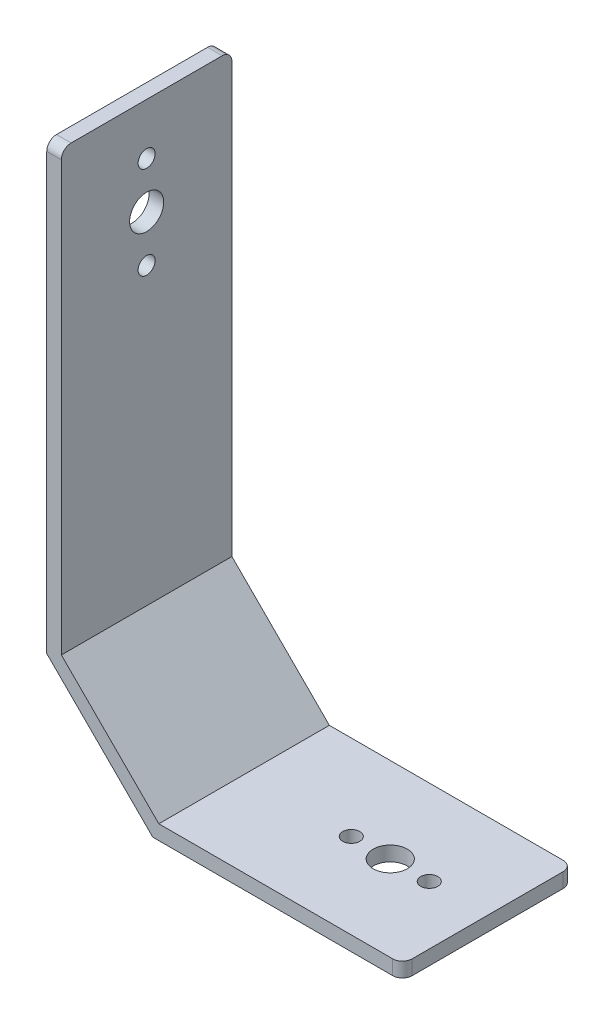
from build123d import *

# Parameters (mm, degrees)
EXTRU_MINCE1_DEPTH      = 35
ESQUISSE2_R             = 1.75
ESQUISSE2_R_2           = 3.5
ENL_V_MAT_EXTRU_1_DEPTH = 3
CONG_3_R                = 2
CONG_4_R                = 2
CONG_5_R                = 2
CONG_6_R                = 2
ESQUISSE3_R             = 1.75
ESQUISSE3_R_2           = 3.5
ENL_V_MAT_EXTRU_2_DEPTH = 10


with BuildPart() as part:
    # Esquisse1 → Extru.-Mince1 (new body)
    with BuildSketch(Plane.XY):
        Polygon((70, -20), (20, -20), (0, 0), (0, 90), (-3, 90), (-3, -1.242640687), (18.757359313, -23), (70, -23), align=None)
    extrude(amount=EXTRU_MINCE1_DEPTH)

    # Esquisse2 → Enlèv. mat.-Extru.1 (cut)
    with BuildSketch(Plane(origin=(0, 0, 0), x_dir=(0, 0, -1), z_dir=(1, 0, 0))):
        with Locations((-17.5, 79.5)):
            Circle(ESQUISSE2_R)
        with Locations((-17.5, 60.5)):
            Circle(ESQUISSE2_R)
        with Locations((-17.5, 70)):
            Circle(ESQUISSE2_R_2)
    extrude(amount=-ENL_V_MAT_EXTRU_1_DEPTH, mode=Mode.SUBTRACT)

    # Congé3
    cong_3_edges = [part.edges().sort_by_distance(p)[0] for p in [
        (-1.5, 90, 35),
    ]]
    fillet(cong_3_edges, radius=CONG_3_R)

    # Congé4
    cong_4_edges = [part.edges().sort_by_distance(p)[0] for p in [
        (-1.5, 90, 0),
    ]]
    fillet(cong_4_edges, radius=CONG_4_R)

    # Congé5
    cong_5_edges = [part.edges().sort_by_distance(p)[0] for p in [
        (70, -21.5, 35),
    ]]
    fillet(cong_5_edges, radius=CONG_5_R)

    # Congé6
    cong_6_edges = [part.edges().sort_by_distance(p)[0] for p in [
        (70, -21.5, 0),
    ]]
    fillet(cong_6_edges, radius=CONG_6_R)

    # Esquisse3 → Enlèv. mat.-Extru.2 (cut)
    with BuildSketch(Plane(origin=(0, -20, 0), x_dir=(1, 0, 0), z_dir=(0, 1, 0))):
        with Locations(Location((58, -17.5, 0), (0, 0, 270))):
            Circle(ESQUISSE3_R)
        with Locations(Location((42, -17.5, 0), (0, 0, 270))):
            Circle(ESQUISSE3_R)
        with Locations(Location((50, -17.5, 0), (0, 0, 270))):
            Circle(ESQUISSE3_R_2)
    extrude(amount=-ENL_V_MAT_EXTRU_2_DEPTH, mode=Mode.SUBTRACT)


solid = part.part
